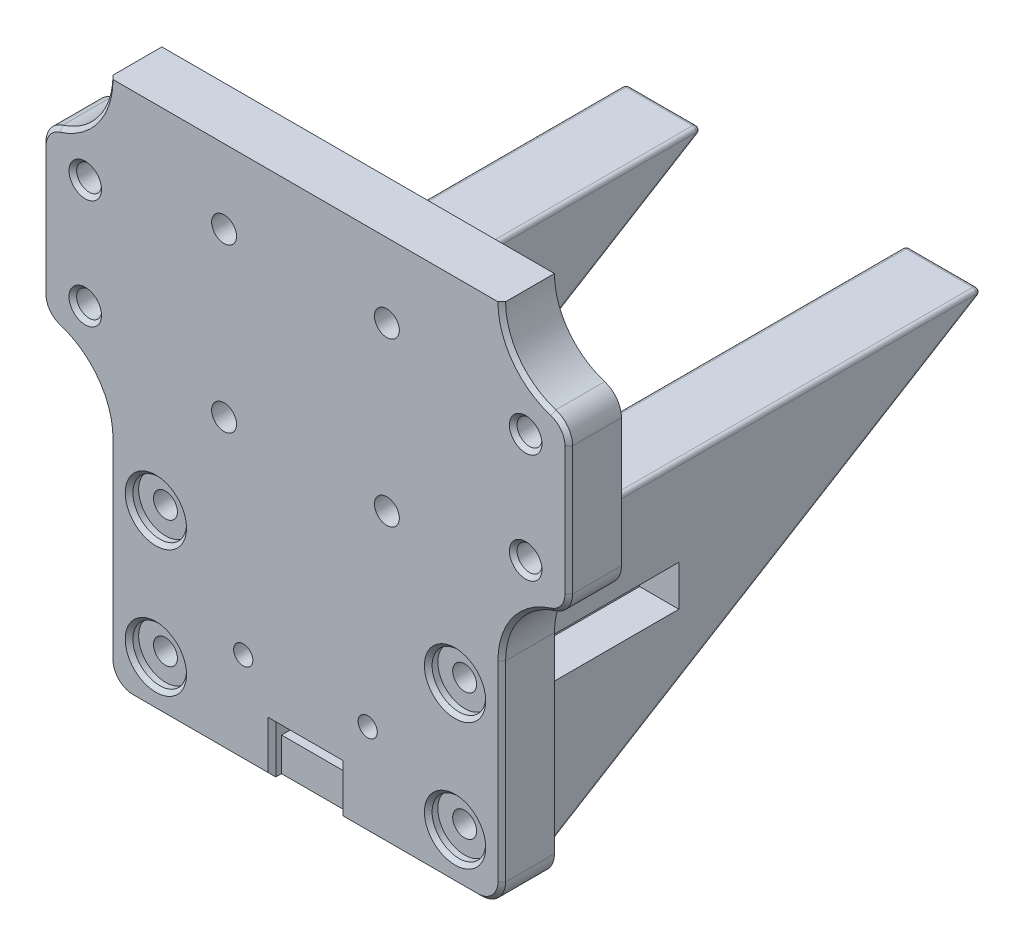
from build123d import *

# Parameters (mm, degrees)
SKETCH1_W             = 82
SKETCH1_H             = 155
SKETCH1_R             = 2.5
BOSS_EXTRUDE1_DEPTH   = 11
SKETCH6_W             = 110
SKETCH6_H             = 36.8
BOSS_EXTRUDE4_DEPTH   = 11
SKETCH9_W             = 14
SKETCH9_H             = 3
CUT_EXTRUDE2_DEPTH    = 96.667392564
FILLET1_R             = 5
SKETCH10_R            = 2.6
CUT_EXTRUDE3_DEPTH    = 96.667392564
FILLET3_R             = 15
SKETCH14_R            = 5.6
CUT_EXTRUDE7_DEPTH    = 2
SKETCH18_W            = 14
SKETCH18_H            = 7
CUT_EXTRUDE10_DEPTH   = 2
BOSS_EXTRUDE5_DEPTH   = 37
CUT_EXTRUDE8_DEPTH    = 21.5
CHAMFER2_SIZE         = 0.8
SKETCH11_R            = 2
CUT_EXTRUDE4_DEPTH    = 135.373546602
CUT_EXTRUDE5_DEPTH    = 2.6
CUT_EXTRUDE9_DEPTH    = 30
FILLET4_R             = 0.8
CORTAR_EXTRUIR1_START = -11
CROQUIS1_R            = 5
CORTAR_EXTRUIR1_DEPTH = 11
CORTAR_EXTRUIR2_DEPTH = 11


with BuildPart() as part:
    # Sketch1 → Boss-Extrude1 (new body)
    with BuildSketch(Plane.XY):
        Rectangle(SKETCH1_W, SKETCH1_H)
        with Locations((31.25, 41)):
            Circle(SKETCH1_R, mode=Mode.SUBTRACT)
        with Locations((31.25, -41)):
            Circle(SKETCH1_R, mode=Mode.SUBTRACT)
        with Locations((-31.25, -41)):
            Circle(SKETCH1_R, mode=Mode.SUBTRACT)
        with Locations((-31.25, 41)):
            Circle(SKETCH1_R, mode=Mode.SUBTRACT)
        with Locations((-31.25, 67.5)):
            Circle(SKETCH1_R, mode=Mode.SUBTRACT)
        with Locations((31.25, 67.5)):
            Circle(SKETCH1_R, mode=Mode.SUBTRACT)
        with Locations((31.25, -67.5)):
            Circle(SKETCH1_R, mode=Mode.SUBTRACT)
        with Locations((-31.25, -67.5)):
            Circle(SKETCH1_R, mode=Mode.SUBTRACT)
    extrude(amount=BOSS_EXTRUDE1_DEPTH)

    # Sketch6 → Boss-Extrude4 (add)
    with BuildSketch(Plane.XY.offset(11)):
        Rectangle(SKETCH6_W, SKETCH6_H)
    extrude(amount=-BOSS_EXTRUDE4_DEPTH)

    # Sketch9 → Cut-Extrude2 (cut, through all)
    with BuildSketch(Plane(origin=(0, 0, 0), x_dir=(-1, 0, 0), z_dir=(0, 0, -1))):
        with Locations((0, 69)):
            Rectangle(SKETCH9_W, SKETCH9_H)
        with Locations((0, -69)):
            Rectangle(SKETCH9_W, SKETCH9_H)
    extrude(amount=-CUT_EXTRUDE2_DEPTH, mode=Mode.SUBTRACT)

    # Fillet1
    fillet1_edges = [part.edges().sort_by_distance(p)[0] for p in [
        (-55, 18.4, 5.5),
        (55, -18.4, 5.5),
        (-55, -18.4, 5.5),
        (55, 18.4, 5.5),
        (41, -77.5, 5.5),
        (-41, -77.5, 5.5),
        (-41, 77.5, 5.5),
        (41, 77.5, 5.5),
    ]]
    fillet(fillet1_edges, radius=FILLET1_R)

    # Sketch10 → Cut-Extrude3 (cut, through all)
    with BuildSketch(Plane(origin=(0, 0, 0), x_dir=(-1, 0, 0), z_dir=(0, 0, -1))):
        with Locations((-46, 11.4)):
            Circle(SKETCH10_R)
        with Locations((-46, -11.4)):
            Circle(SKETCH10_R)
        with Locations(Location((46, -11.4, 0), (0, 0, 180))):
            Circle(SKETCH10_R)
        with Locations(Location((46, 11.4, 0), (0, 0, 180))):
            Circle(SKETCH10_R)
    extrude(amount=-CUT_EXTRUDE3_DEPTH, mode=Mode.SUBTRACT)

    # Fillet3
    fillet3_edges = [part.edges().sort_by_distance(p)[0] for p in [
        (41, -18.4, 5.5),
        (-41, -18.4, 5.5),
        (-41, 18.4, 5.5),
        (41, 18.4, 5.5),
    ]]
    fillet(fillet3_edges, radius=FILLET3_R)

    # Sketch14 → Cut-Extrude7 (cut)
    with BuildSketch(Plane.XY.offset(11)):
        with Locations((31.25, -41)):
            Circle(SKETCH14_R)
        with Locations((31.25, -67.5)):
            Circle(SKETCH14_R)
        with Locations((31.25, 41)):
            Circle(SKETCH14_R)
        with Locations((31.25, 67.5)):
            Circle(SKETCH14_R)
        with Locations((-31.25, 67.5)):
            Circle(SKETCH14_R)
        with Locations((-31.25, 41)):
            Circle(SKETCH14_R)
        with Locations((-31.25, -41)):
            Circle(SKETCH14_R)
        with Locations((-31.25, -67.5)):
            Circle(SKETCH14_R)
    extrude(amount=-CUT_EXTRUDE7_DEPTH, mode=Mode.SUBTRACT)

    # Sketch18 → Cut-Extrude10 (cut)
    with BuildSketch(Plane.XY.offset(11)):
        with Locations((0, 74)):
            Rectangle(SKETCH18_W, SKETCH18_H)
        with Locations((0, -74)):
            Rectangle(SKETCH18_W, SKETCH18_H)
    extrude(amount=-CUT_EXTRUDE10_DEPTH, mode=Mode.SUBTRACT)

    # Sketch16 → Boss-Extrude5 (add, symmetric)
    with BuildSketch(Plane(origin=(0, 0, 0), x_dir=(0, 0, -1), z_dir=(1, 0, 0))):
        Polygon((0, -18.5), (0, -76.5), (95, -18.5), align=None)
    extrude(amount=BOSS_EXTRUDE5_DEPTH, both=True)

    # Sketch16<2> → Cut-Extrude8 (cut, symmetric)
    with BuildSketch(Plane(origin=(0, 0, 0), x_dir=(0, 0, -1), z_dir=(1, 0, 0))):
        Polygon((0, -18.5), (0, -76.5), (95, -18.5), align=None)
    extrude(amount=CUT_EXTRUDE8_DEPTH, both=True, mode=Mode.SUBTRACT)

    # Chamfer2
    chamfer2_edges = [part.edges().sort_by_distance(p)[0] for p in [
        (41, -52.489392014, 11),
        (-21.5, -77.5, 11),
        (55, 0, 11),
        (21.5, 77.5, 11),
        (-41, 52.489392014, 11),
        (-55, 0, 11),
        (39.535533906, 76.035533906, 11),
        (54.031128874, 16.358039892, 11),
        (-39.535533906, 76.035533906, 11),
        (-54.031128874, -16.358039892, 11),
        (-39.535533906, -76.035533906, 11),
        (39.535533906, -76.035533906, 11),
        (-48.6, 11.4, 11),
        (-48.6, -11.4, 11),
        (48.6, -11.4, 11),
        (48.6, 11.4, 11),
        (54.031128874, -16.358039892, 11),
        (-41, -52.489392014, 11),
        (-54.031128874, 16.358039892, 11),
        (41, 52.489392014, 11),
        (43.906613378, -23.604664354, 11),
        (-43.906613378, -23.604664354, 11),
        (-43.906613378, 23.604664354, 11),
        (43.906613378, 23.604664354, 11),
        (25.65, -67.5, 11),
        (25.65, 41, 11),
        (25.65, 67.5, 11),
        (-36.85, 67.5, 11),
        (-36.85, 41, 11),
        (-36.85, -41, 11),
        (-36.85, -67.5, 11),
        (25.65, -41, 11),
        (21.5, -77.5, 11),
        (-21.5, 77.5, 11),
        (-7, 72.5, 11),
        (0, 67.5, 11),
        (7, 72.5, 11),
        (-7, -72.5, 11),
        (7, -72.5, 11),
        (0, -67.5, 11),
    ]]
    chamfer(chamfer2_edges, length=CHAMFER2_SIZE)

    # Sketch11 → Cut-Extrude4 (cut, through all)
    with BuildSketch(Plane(origin=(0, 0, 0), x_dir=(-1, 0, 0), z_dir=(0, 0, -1))):
        with Locations((-13, -58)):
            Circle(SKETCH11_R)
        with Locations(Location((13, -58, 0), (0, 0, 180))):
            Circle(SKETCH11_R)
    extrude(amount=-CUT_EXTRUDE4_DEPTH, mode=Mode.SUBTRACT)

    # Sketch12 → Cut-Extrude5 (cut)
    with BuildSketch(Plane(origin=(0, 0, 0), x_dir=(-1, 0, 0), z_dir=(0, 0, -1))):
        Polygon((14.616580754, -55.2), (11.383419246, -55.2), (9.766838493, -58), (11.383419246, -60.8), (14.616580754, -60.8), (16.233161507, -58), align=None)
        Polygon((-11.383419246, -55.2), (-14.616580754, -55.2), (-16.233161507, -58), (-14.616580754, -60.8), (-11.383419246, -60.8), (-9.766838493, -58), align=None)
    extrude(amount=-CUT_EXTRUDE5_DEPTH, mode=Mode.SUBTRACT)

    # Sketch17 → Cut-Extrude9 (cut)
    with BuildSketch(Plane(origin=(0, 0, 0), x_dir=(-1, 0, 0), z_dir=(0, 0, -1))):
        Polygon((-36.157477288, -41), (-33.703738644, -36.75), (-37, -36.75), (-37, -45.25), (-33.703738644, -45.25), align=None)
        Polygon((37, -36.75), (33.703738644, -36.75), (36.157477288, -41), (33.703738644, -45.25), (37, -45.25), align=None)
        Polygon((33.703738644, -45.25), (36.157477288, -41), (33.703738644, -36.75), (28.796261356, -36.75), (26.342522712, -41), (28.796261356, -45.25), align=None)
        Polygon((33.703738644, -71.75), (36.157477288, -67.5), (33.703738644, -63.25), (28.796261356, -63.25), (26.342522712, -67.5), (28.796261356, -71.75), align=None)
        Polygon((-28.796261356, -71.75), (-26.342522712, -67.5), (-28.796261356, -63.25), (-33.703738644, -63.25), (-36.157477288, -67.5), (-33.703738644, -71.75), align=None)
        Polygon((-28.796261356, -45.25), (-26.342522712, -41), (-28.796261356, -36.75), (-33.703738644, -36.75), (-36.157477288, -41), (-33.703738644, -45.25), align=None)
    extrude(amount=CUT_EXTRUDE9_DEPTH, mode=Mode.SUBTRACT)

    # Fillet4
    fillet4_edges = [part.edges().sort_by_distance(p)[0] for p in [
        (-37, -18.5, -47.5),
        (29.25, -18.5, -95),
        (-37, -47.5, -47.5),
        (37, -18.5, -47.5),
        (37, -47.5, -47.5),
        (-29.25, -18.5, -95),
        (-21.5, -18.5, -47.5),
        (-21.5, -47.5, -47.5),
        (21.5, -18.5, -47.5),
        (21.5, -47.5, -47.5),
    ]]
    fillet(fillet4_edges, radius=FILLET4_R)

    # Croquis1 → Cortar-Extruir1 (cut)
    with BuildSketch(Plane(origin=(0, 0, 0), x_dir=(-1, 0, 0), z_dir=(0, 0, -1)).offset(CORTAR_EXTRUIR1_START)):
        with BuildLine():
            Line((-41, 72.5), (-41, 32.478784028))
            Line((-41, 32.478784028), (41, 32.478784028))
            Line((41, 32.478784028), (41, 72.5))
            ThreePointArc((41, 72.5), (32.464466094, 68.964466094), (36, 77.5))
            Line((36, 77.5), (-36, 77.5))
            ThreePointArc((-36, 77.5), (-32.464466094, 76.035533906), (-31, 72.5))
            ThreePointArc((-31, 72.5), (-36, 67.5), (-41, 72.5))
        make_face()
        with Locations((36, 72.5)):
            Circle(CROQUIS1_R)
        with Locations((-36, 72.5)):
            Circle(CROQUIS1_R)
    extrude(amount=CORTAR_EXTRUIR1_DEPTH, mode=Mode.SUBTRACT)

    # Croquis2 → Cortar-Extruir2 (cut)
    with BuildSketch(Plane(origin=(0, 0, 0), x_dir=(-1, 0, 0), z_dir=(0, 0, -1))):
        with BuildLine():
            ThreePointArc((14.4, 17), (15.161522369, 15.161522369), (17, 14.4))
            Line((17, 14.4), (17, 17))
            Line((17, 17), (14.4, 17))
        make_face()
        with BuildLine():
            Line((17, 17), (17, 14.4))
            ThreePointArc((17, 14.4), (18.838477631, 15.161522369), (19.6, 17))
            ThreePointArc((19.6, 17), (17, 19.6), (14.4, 17))
            Line((14.4, 17), (17, 17))
        make_face()
        with BuildLine():
            ThreePointArc((19.6, -17), (18.838477631, -15.161522369), (17, -14.4))
            Line((17, -14.4), (17, -17))
            Line((17, -17), (14.4, -17))
            ThreePointArc((14.4, -17), (17, -19.6), (19.6, -17))
        make_face()
        with BuildLine():
            Line((17, -17), (17, -14.4))
            ThreePointArc((17, -14.4), (15.161522369, -15.161522369), (14.4, -17))
            Line((14.4, -17), (17, -17))
        make_face()
        with BuildLine():
            ThreePointArc((-14.4, -17), (-15.161522369, -15.161522369), (-17, -14.4))
            Line((-17, -14.4), (-17, -17))
            Line((-17, -17), (-14.4, -17))
        make_face()
        with BuildLine():
            Line((-17, -17), (-17, -14.4))
            ThreePointArc((-17, -14.4), (-18.838477631, -18.838477631), (-14.4, -17))
            Line((-14.4, -17), (-17, -17))
        make_face()
        with BuildLine():
            ThreePointArc((-14.4, 17), (-18.838477631, 18.838477631), (-17, 14.4))
            Line((-17, 14.4), (-17, 17))
            Line((-17, 17), (-14.4, 17))
        make_face()
        with BuildLine():
            Line((-17, 17), (-17, 14.4))
            ThreePointArc((-17, 14.4), (-15.161522369, 15.161522369), (-14.4, 17))
            Line((-14.4, 17), (-17, 17))
        make_face()
    extrude(amount=-CORTAR_EXTRUIR2_DEPTH, mode=Mode.SUBTRACT)


solid = part.part
